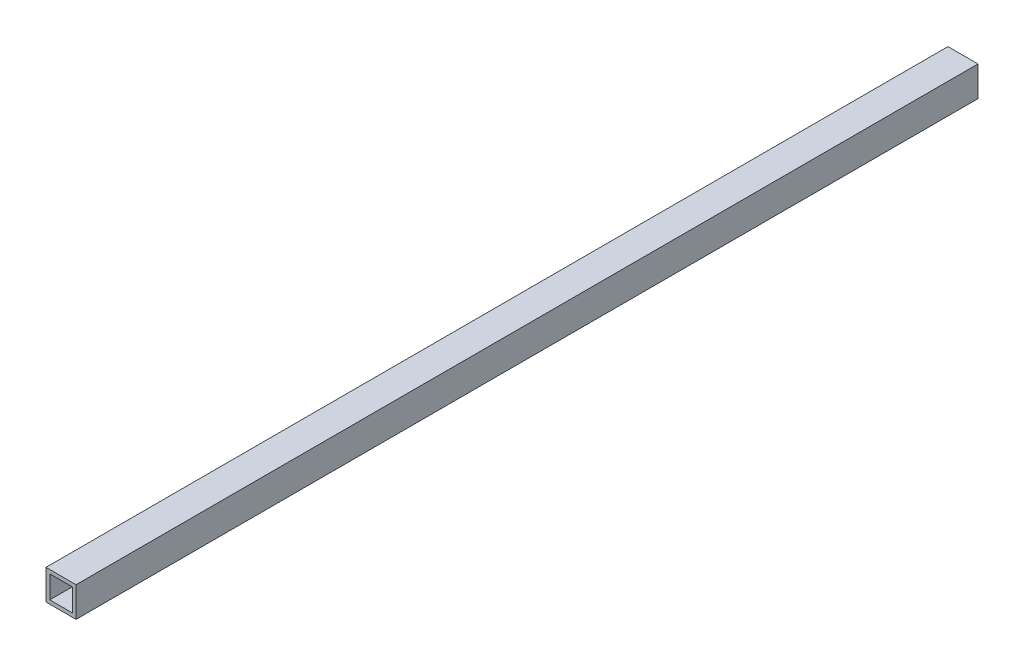
from build123d import *

# Parameters (mm, degrees)
BOSS_EXTRUDE1_DEPTH      = 381
BOSS_EXTRUDE1_DEPTH_BACK = 381
SKETCH3_W                = 25.4
SKETCH3_H                = 25.4
SKETCH3_W_2              = 19.05
SKETCH3_H_2              = 19.05


with BuildPart() as part:
    # Sketch3 → Boss-Extrude1 (new, two sides: drawn at the far end of the back side and taken through both)
    with BuildSketch(Plane.XY.offset(-BOSS_EXTRUDE1_DEPTH_BACK)):
        Rectangle(SKETCH3_W, SKETCH3_H)
        Rectangle(SKETCH3_W_2, SKETCH3_H_2, mode=Mode.SUBTRACT)
    extrude(amount=BOSS_EXTRUDE1_DEPTH + BOSS_EXTRUDE1_DEPTH_BACK)


solid = part.part
